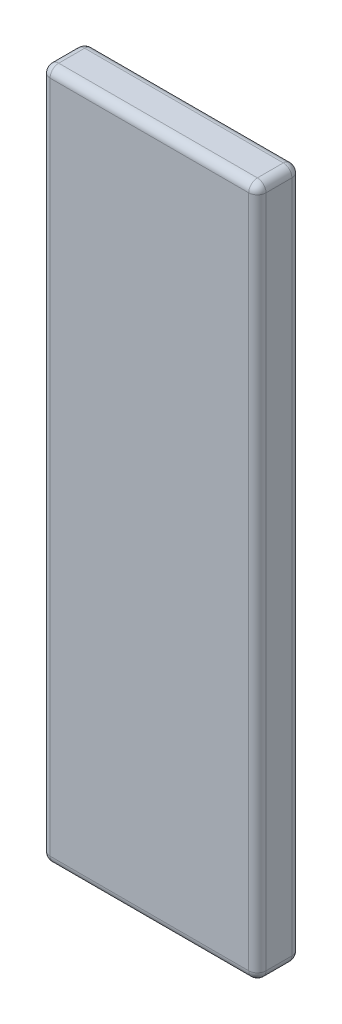
from build123d import *

# Parameters (mm, degrees)
SKETCH1_W           = 2.5
SKETCH1_H           = 8
BOSS_EXTRUDE1_DEPTH = 0.5
FILLET1_R           = 0.1


with BuildPart() as part:
    # Sketch1 → Boss-Extrude1 (new body)
    with BuildSketch(Plane.XY):
        Rectangle(SKETCH1_W, SKETCH1_H)
    extrude(amount=BOSS_EXTRUDE1_DEPTH)

    # Fillet1
    fillet1_edges = [part.edges().sort_by_distance(p)[0] for p in [
        (-1.25, 0, 0.5),
        (0, -4, 0.5),
        (1.25, 0, 0.5),
        (0, -4, 0),
        (-1.25, 0, 0),
        (0, 4, 0),
        (1.25, 0, 0),
        (0, 4, 0.5),
        (1.25, -4, 0.25),
        (-1.25, -4, 0.25),
        (-1.25, 4, 0.25),
        (1.25, 4, 0.25),
    ]]
    fillet(fillet1_edges, radius=FILLET1_R)


solid = part.part
